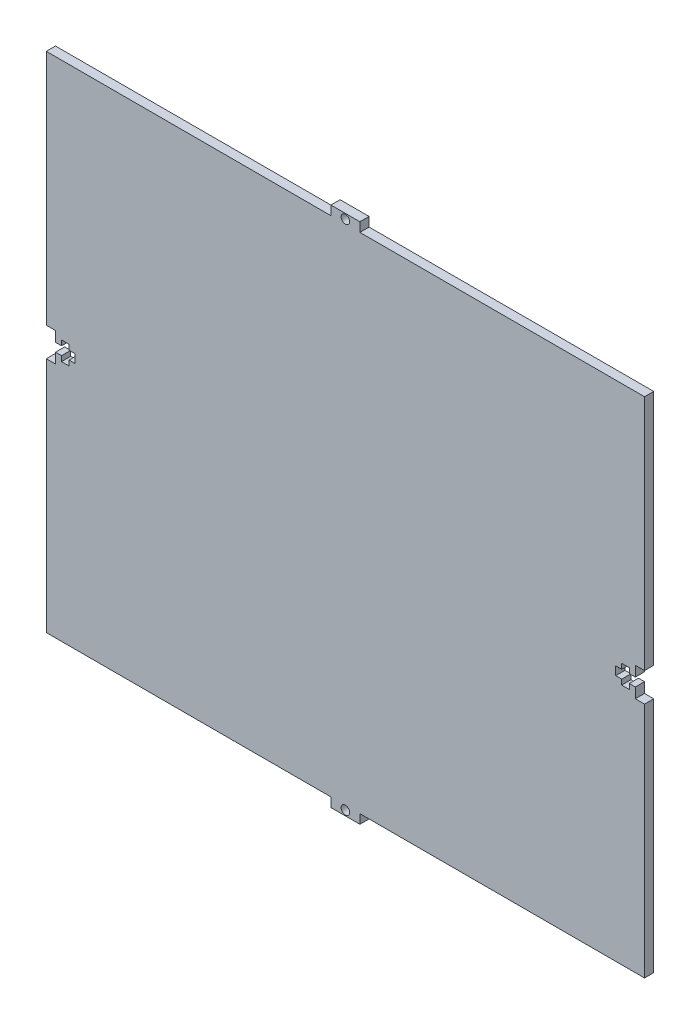
from build123d import *

# Parameters (mm, degrees)
SKETCH2_W           = 206.36
SKETCH2_H           = 173.64
BOSS_EXTRUDE1_DEPTH = 3.18
CUT_EXTRUDE1_DEPTH  = 135.884903529
SKETCH9_W           = 10
SKETCH9_H           = 3.18
BOSS_EXTRUDE4_DEPTH = 3.18
SKETCH11_R          = 1.47
CUT_EXTRUDE3_DEPTH  = 137.953367246


with BuildPart() as part:
    # Sketch2 → Boss-Extrude1 (new body)
    with BuildSketch(Plane.XY):
        Rectangle(SKETCH2_W, SKETCH2_H)
    extrude(amount=BOSS_EXTRUDE1_DEPTH)

    # Sketch3 → Cut-Extrude1 (cut, through all)
    with BuildSketch(Plane.XY.offset(3.18)):
        Polygon((-95.32, -1.47), (-95.32, -3.25), (-97.92, -3.25), (-97.92, -1.47), (-100, -1.47), (-100, -5), (-103.18, -5), (-103.18, 5), (-100, 5), (-100, 1.47), (-97.92, 1.47), (-97.92, 3.25), (-95.32, 3.25), (-95.32, 1.47), (-93.25, 1.47), (-93.25, -1.47), align=None)
    cut_extrude1 = extrude(amount=-CUT_EXTRUDE1_DEPTH, mode=Mode.SUBTRACT)

    # Sketch9 → Boss-Extrude4 (add)
    with BuildSketch(Plane(origin=(0, 86.82, 0), x_dir=(1, 0, 0), z_dir=(0, 1, 0))):
        with Locations((0, -1.59)):
            Rectangle(SKETCH9_W, SKETCH9_H)
    boss_extrude4 = extrude(amount=BOSS_EXTRUDE4_DEPTH)

    # Sketch11 → Cut-Extrude3 (cut, through all)
    with BuildSketch(Plane.XY.offset(3.18)):
        with Locations((0, 88.25)):
            Circle(SKETCH11_R)
    cut_extrude3 = extrude(amount=-CUT_EXTRUDE3_DEPTH, mode=Mode.SUBTRACT)

    # Mirror1: Cut-Extrude1 across plane
    add(cut_extrude1.mirror(Plane(origin=(0, 0, 0), x_dir=(0, 0, 1), z_dir=(1, 0, 0))), mode=Mode.SUBTRACT)

    # Mirror2: Boss-Extrude4, Cut-Extrude3 across plane
    add(boss_extrude4.mirror(Plane.ZX))
    add(cut_extrude3.mirror(Plane.ZX), mode=Mode.SUBTRACT)


solid = part.part
